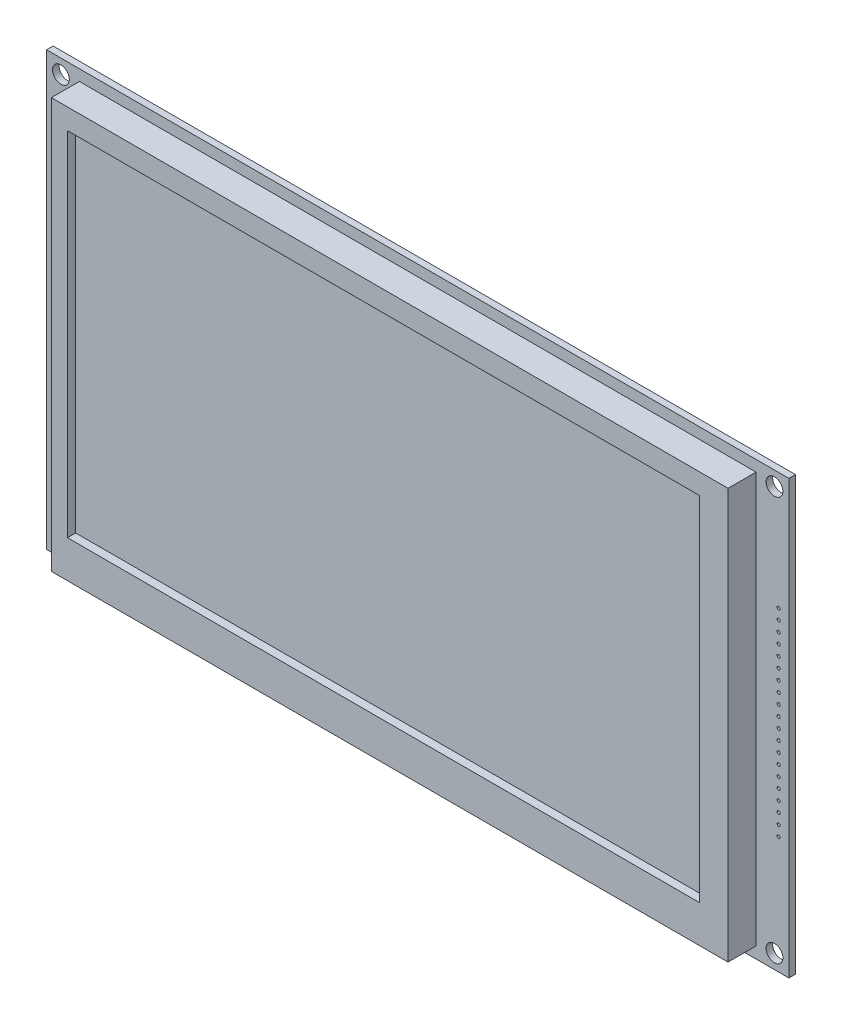
from build123d import *

# Parameters (mm, degrees)
SKETCH1_W               = 180.9
SKETCH1_H               = 105.45
SKETCH1_R               = 2.05
BOSS_EXTRUDE1_DEPTH     = 0.8
SKETCH2_W               = 164.9
SKETCH2_H               = 100
BOSS_EXTRUDE2_DEPTH     = 6.83
BOSS_EXTRUDE3_DEPTH     = 11
SKETCH4_W               = 7
SKETCH4_H               = 4
BOSS_EXTRUDE4_DEPTH     = 1.5
CUT_EXTRUDE1_DEPTH      = 106.034246915
CUT_EXTRUDE1_DEPTH_BACK = 106.034246915
SKETCH5_R               = 0.38
SKETCH6_W               = 154.08
SKETCH6_H               = 85.92
CUT_EXTRUDE2_DEPTH      = 2


with BuildPart() as part:
    # Sketch1 → Boss-Extrude1 (new, symmetric)
    with BuildSketch(Plane.XY):
        Rectangle(SKETCH1_W, SKETCH1_H)
        with Locations((86.95, 49.245)):
            Circle(SKETCH1_R, mode=Mode.SUBTRACT)
        with Locations((-86.96, 49.245)):
            Circle(SKETCH1_R, mode=Mode.SUBTRACT)
        with Locations((-86.96, -49.225)):
            Circle(SKETCH1_R, mode=Mode.SUBTRACT)
        with Locations((86.95, -49.225)):
            Circle(SKETCH1_R, mode=Mode.SUBTRACT)
    extrude(amount=BOSS_EXTRUDE1_DEPTH, both=True)

    # Sketch2 → Boss-Extrude2 (add)
    with BuildSketch(Plane.XY.offset(0.8)):
        with Locations((0, 0.045)):
            Rectangle(SKETCH2_W, SKETCH2_H)
    extrude(amount=BOSS_EXTRUDE2_DEPTH)

    # Sketch3 → Boss-Extrude3 (add)
    with BuildSketch(Plane.XZ.offset(52.725)):
        with BuildLine():
            Line((17.37, -0.8), (23.15, -0.8))
            ThreePointArc((23.15, -0.8), (24.267228714, -1.262771286), (24.73, -2.38))
            Line((24.73, -2.38), (24.73, -2.48))
            ThreePointArc((24.73, -2.48), (24.267228714, -3.597228714), (23.15, -4.06))
            Line((23.15, -4.06), (17.37, -4.06))
            ThreePointArc((17.37, -4.06), (16.252771286, -3.597228714), (15.79, -2.48))
            Line((15.79, -2.48), (15.79, -2.38))
            ThreePointArc((15.79, -2.38), (16.252771286, -1.262771286), (17.37, -0.8))
        make_face()
        with BuildLine():
            Line((-0.91, -0.8), (4.87, -0.8))
            ThreePointArc((4.87, -0.8), (5.987228714, -1.262771286), (6.45, -2.38))
            Line((6.45, -2.38), (6.45, -2.48))
            ThreePointArc((6.45, -2.48), (5.987228714, -3.597228714), (4.87, -4.06))
            Line((4.87, -4.06), (-0.91, -4.06))
            ThreePointArc((-0.91, -4.06), (-2.027228714, -3.597228714), (-2.49, -2.48))
            Line((-2.49, -2.48), (-2.49, -2.38))
            ThreePointArc((-2.49, -2.38), (-2.027228714, -1.262771286), (-0.91, -0.8))
        make_face()
    extrude(amount=-BOSS_EXTRUDE3_DEPTH)

    # Sketch4 → Boss-Extrude4 (add)
    with BuildSketch(Plane(origin=(0, 0, -0.8), x_dir=(-1, 0, 0), z_dir=(0, 0, -1))):
        with Locations((66.42, -50.205)):
            Rectangle(SKETCH4_W, SKETCH4_H)
        with Locations((76.91, -50.205)):
            Rectangle(SKETCH4_W, SKETCH4_H)
    extrude(amount=BOSS_EXTRUDE4_DEPTH)

    # Sketch5 → Cut-Extrude1 (cut, two sides: drawn at the far end of the back side and taken through both)
    with BuildSketch(Plane(origin=(0, 0, -0.8), x_dir=(-1, 0, 0), z_dir=(0, 0, -1)).offset(-CUT_EXTRUDE1_DEPTH_BACK)):
        with Locations(Location((87.95, 24.125, 0), (0, 0, 180))):
            Circle(SKETCH5_R)
        with Locations(Location((87.95, 21.585, 0), (0, 0, 180))):
            Circle(SKETCH5_R)
        with Locations(Location((87.95, 19.045, 0), (0, 0, 180))):
            Circle(SKETCH5_R)
        with Locations(Location((87.95, 16.505, 0), (0, 0, 180))):
            Circle(SKETCH5_R)
        with Locations(Location((87.95, 13.965, 0), (0, 0, 180))):
            Circle(SKETCH5_R)
        with Locations(Location((87.95, 11.425, 0), (0, 0, 180))):
            Circle(SKETCH5_R)
        with Locations(Location((87.95, 8.885, 0), (0, 0, 180))):
            Circle(SKETCH5_R)
        with Locations(Location((87.95, 6.345, 0), (0, 0, 180))):
            Circle(SKETCH5_R)
        with Locations(Location((87.95, 3.805, 0), (0, 0, 180))):
            Circle(SKETCH5_R)
        with Locations(Location((87.95, 1.265, 0), (0, 0, 180))):
            Circle(SKETCH5_R)
        with Locations(Location((87.95, -1.275, 0), (0, 0, 180))):
            Circle(SKETCH5_R)
        with Locations(Location((87.95, -3.815, 0), (0, 0, 180))):
            Circle(SKETCH5_R)
        with Locations(Location((87.95, -6.355, 0), (0, 0, 180))):
            Circle(SKETCH5_R)
        with Locations(Location((87.95, -8.895, 0), (0, 0, 180))):
            Circle(SKETCH5_R)
        with Locations(Location((87.95, -11.435, 0), (0, 0, 180))):
            Circle(SKETCH5_R)
        with Locations(Location((87.95, -13.975, 0), (0, 0, 180))):
            Circle(SKETCH5_R)
        with Locations(Location((87.95, -16.515, 0), (0, 0, 180))):
            Circle(SKETCH5_R)
        with Locations(Location((87.95, -19.055, 0), (0, 0, 180))):
            Circle(SKETCH5_R)
        with Locations(Location((87.95, -21.595, 0), (0, 0, 180))):
            Circle(SKETCH5_R)
        with Locations(Location((87.95, -24.135, 0), (0, 0, 180))):
            Circle(SKETCH5_R)
        with Locations(Location((-87.96, 24.095, 0), (0, 0, 180))):
            Circle(SKETCH5_R)
        with Locations(Location((-87.96, 21.555, 0), (0, 0, 180))):
            Circle(SKETCH5_R)
        with Locations(Location((-87.96, 19.015, 0), (0, 0, 180))):
            Circle(SKETCH5_R)
        with Locations(Location((-87.96, 16.475, 0), (0, 0, 180))):
            Circle(SKETCH5_R)
        with Locations(Location((-87.96, 13.935, 0), (0, 0, 180))):
            Circle(SKETCH5_R)
        with Locations(Location((-87.96, 11.395, 0), (0, 0, 180))):
            Circle(SKETCH5_R)
        with Locations(Location((-87.96, 8.855, 0), (0, 0, 180))):
            Circle(SKETCH5_R)
        with Locations(Location((-87.96, 6.315, 0), (0, 0, 180))):
            Circle(SKETCH5_R)
        with Locations(Location((-87.96, 3.775, 0), (0, 0, 180))):
            Circle(SKETCH5_R)
        with Locations(Location((-87.96, 1.235, 0), (0, 0, 180))):
            Circle(SKETCH5_R)
        with Locations(Location((-87.96, -1.305, 0), (0, 0, 180))):
            Circle(SKETCH5_R)
        with Locations(Location((-87.96, -3.845, 0), (0, 0, 180))):
            Circle(SKETCH5_R)
        with Locations(Location((-87.96, -6.385, 0), (0, 0, 180))):
            Circle(SKETCH5_R)
        with Locations(Location((-87.96, -8.925, 0), (0, 0, 180))):
            Circle(SKETCH5_R)
        with Locations(Location((-87.96, -11.465, 0), (0, 0, 180))):
            Circle(SKETCH5_R)
        with Locations(Location((-87.96, -14.005, 0), (0, 0, 180))):
            Circle(SKETCH5_R)
        with Locations(Location((-87.96, -16.545, 0), (0, 0, 180))):
            Circle(SKETCH5_R)
        with Locations(Location((-87.96, -19.085, 0), (0, 0, 180))):
            Circle(SKETCH5_R)
        with Locations(Location((-87.96, -21.625, 0), (0, 0, 180))):
            Circle(SKETCH5_R)
        with Locations(Location((-87.96, -24.165, 0), (0, 0, 180))):
            Circle(SKETCH5_R)
    extrude(amount=CUT_EXTRUDE1_DEPTH + CUT_EXTRUDE1_DEPTH_BACK, mode=Mode.SUBTRACT)

    # Sketch6 → Cut-Extrude2 (cut)
    with BuildSketch(Plane.XY.offset(7.63)):
        with Locations((-1.48, 2.085)):
            Rectangle(SKETCH6_W, SKETCH6_H)
    extrude(amount=-CUT_EXTRUDE2_DEPTH, mode=Mode.SUBTRACT)


solid = part.part
